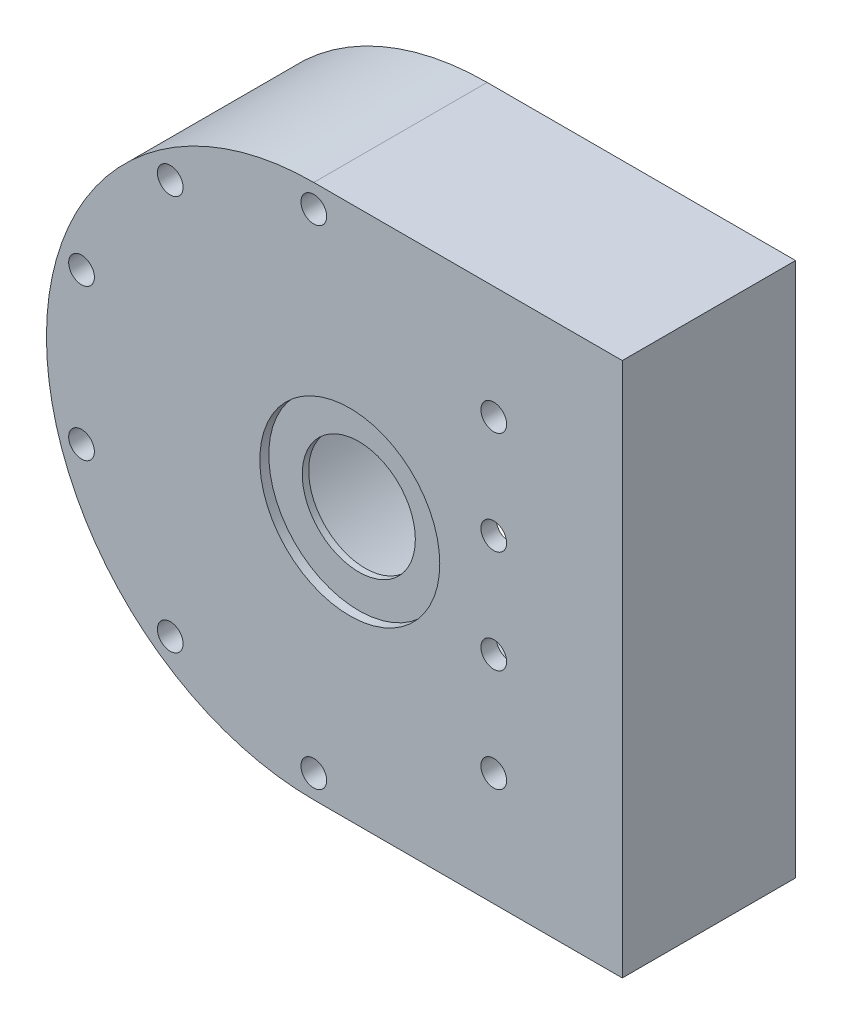
from build123d import *

# Parameters (mm, degrees)
CROQUIS1_R              = 30.25
SALIENTE_EXTRUIR1_DEPTH = 30.7
CROQUIS2_R              = 11
SALIENTE_EXTRUIR2_DEPTH = 3
CROQUIS3_R              = 17.5
CORTAR_EXTRUIR1_DEPTH   = 1.75
CROQUIS4_R              = 2.5
CORTAR_EXTRUIR2_DEPTH   = 87.253637604


with BuildPart() as part:
    # Croquis1 → Saliente-Extruir1 (new body)
    with BuildSketch(Plane.XY):
        with BuildLine():
            Line((0, -52), (60, -52))
            Line((60, -52), (60, 52))
            Line((60, 52), (0, 52))
            ThreePointArc((0, 52), (-52, 0), (0, -52))
        make_face()
        with Locations((7, 0)):
            Circle(CROQUIS1_R, mode=Mode.SUBTRACT)
    extrude(amount=SALIENTE_EXTRUIR1_DEPTH)

    # Croquis2 → Saliente-Extruir2 (add)
    with BuildSketch(Plane.XY.offset(30.7)):
        with BuildLine():
            Line((0, -52), (60, -52))
            Line((60, -52), (60, 52))
            Line((60, 52), (0, 52))
            ThreePointArc((0, 52), (-52, 0), (0, -52))
        make_face()
        with Locations((7, 0)):
            Circle(CROQUIS2_R, mode=Mode.SUBTRACT)
    extrude(amount=SALIENTE_EXTRUIR2_DEPTH)

    # Croquis3 → Cortar-Extruir1 (cut)
    with BuildSketch(Plane.XY.offset(33.7)):
        with Locations((7, 0)):
            Circle(CROQUIS3_R)
    extrude(amount=-CORTAR_EXTRUIR1_DEPTH, mode=Mode.SUBTRACT)

    # Croquis4 → Cortar-Extruir2 (cut, through all)
    with BuildSketch(Plane.XY.offset(33.7)):
        with Locations((35, 30)):
            Circle(CROQUIS4_R)
        with Locations((0, 47.5)):
            Circle(CROQUIS4_R)
        with Locations((-27.919799484, 38.428307233)):
            Circle(CROQUIS4_R)
        with Locations((-45.175184524, 14.678307233)):
            Circle(CROQUIS4_R)
        with Locations((-45.175184524, -14.678307233)):
            Circle(CROQUIS4_R)
        with Locations((-27.919799484, -38.428307233)):
            Circle(CROQUIS4_R)
        with Locations((0, -47.5)):
            Circle(CROQUIS4_R)
        with Locations((35, 10)):
            Circle(CROQUIS4_R)
        with Locations((35, -10)):
            Circle(CROQUIS4_R)
        with Locations((35, -30)):
            Circle(CROQUIS4_R)
    extrude(amount=-CORTAR_EXTRUIR2_DEPTH, mode=Mode.SUBTRACT)


solid = part.part
